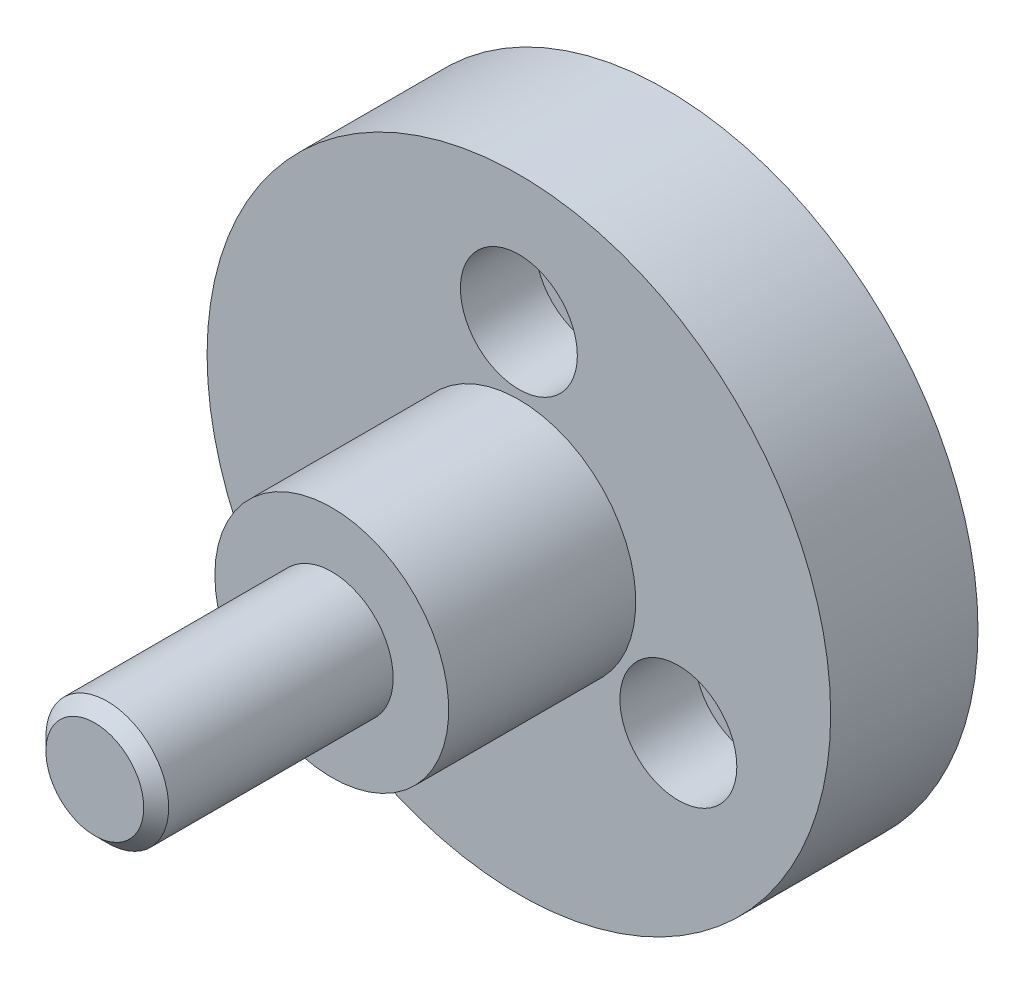
from build123d import *

# Parameters (mm, degrees)
SKETCH1_R                    = 12.7
MOUNTING_FLANGE_DEPTH        = 6
SKETCH3_R                    = 6.35
MOTOR_SHAFT_RELIEF_DEPTH     = 2.54
SKETCH2_R                    = 2.5
DRIVE_SHAFT_DEPTH            = 17.272
CHAMFER1_SIZE                = 0.508
SKETCH5_R                    = 4.7625
SHAFT_SUPPORT_SHOULDER_DEPTH = 7.62
M2_5_CLEARANCE_HOLE_D        = 2.9
SKETCH8_R                    = 2.38125
M2_5_TIGHT_COUTERBORE_DEPTH  = 3.048
CIRPATTERN_COUNT             = 3


with BuildPart() as part:
    # Sketch1 → Mounting Flange (new body)
    with BuildSketch(Plane.XY):
        Circle(SKETCH1_R)
    extrude(amount=MOUNTING_FLANGE_DEPTH)

    # Sketch3 → Motor Shaft Relief (cut)
    with BuildSketch(Plane(origin=(0, 0, 0), x_dir=(-1, 0, 0), z_dir=(0, 0, -1))):
        Circle(SKETCH3_R)
    extrude(amount=-MOTOR_SHAFT_RELIEF_DEPTH, mode=Mode.SUBTRACT)

    # Sketch2 → Drive Shaft (add)
    with BuildSketch(Plane.XY.offset(6)):
        Circle(SKETCH2_R)
    extrude(amount=DRIVE_SHAFT_DEPTH)

    # Chamfer1
    chamfer1_edges = [part.edges().sort_by_distance(p)[0] for p in [
        (-2.5, 0, 23.272),
    ]]
    chamfer(chamfer1_edges, length=CHAMFER1_SIZE)

    # Sketch5 → Shaft Support Shoulder (add)
    with BuildSketch(Plane.XY.offset(6)):
        with Locations(Location((0, 0, 0), (0, 0, 180))):
            Circle(SKETCH5_R)
    extrude(amount=SHAFT_SUPPORT_SHOULDER_DEPTH)

    # M2.5 Clearance Hole (through all)
    with Locations(Plane.XY.offset(6)):
        with Locations((0, 7.5)):
            m2_5_clearance_hole = Hole(M2_5_CLEARANCE_HOLE_D / 2)

    # Sketch8 → M2.5 Tight Couterbore (cut)
    with BuildSketch(Plane.XY.offset(6)):
        with Locations((0, 7.5)):
            Circle(SKETCH8_R)
    m2_5_tight_couterbore = extrude(amount=-M2_5_TIGHT_COUTERBORE_DEPTH, mode=Mode.SUBTRACT)

    # CirPattern: M2.5 Clearance Hole, M2.5 Tight Couterbore ×3 about axis
    cirpattern_axis = Axis((0, 0, 0), (0, 0, 1))
    add([m2_5_clearance_hole.rotate(cirpattern_axis, i * 360 / CIRPATTERN_COUNT) for i in range(1, CIRPATTERN_COUNT)], mode=Mode.SUBTRACT)
    add([m2_5_tight_couterbore.rotate(cirpattern_axis, i * 360 / CIRPATTERN_COUNT) for i in range(1, CIRPATTERN_COUNT)], mode=Mode.SUBTRACT)


solid = part.part
